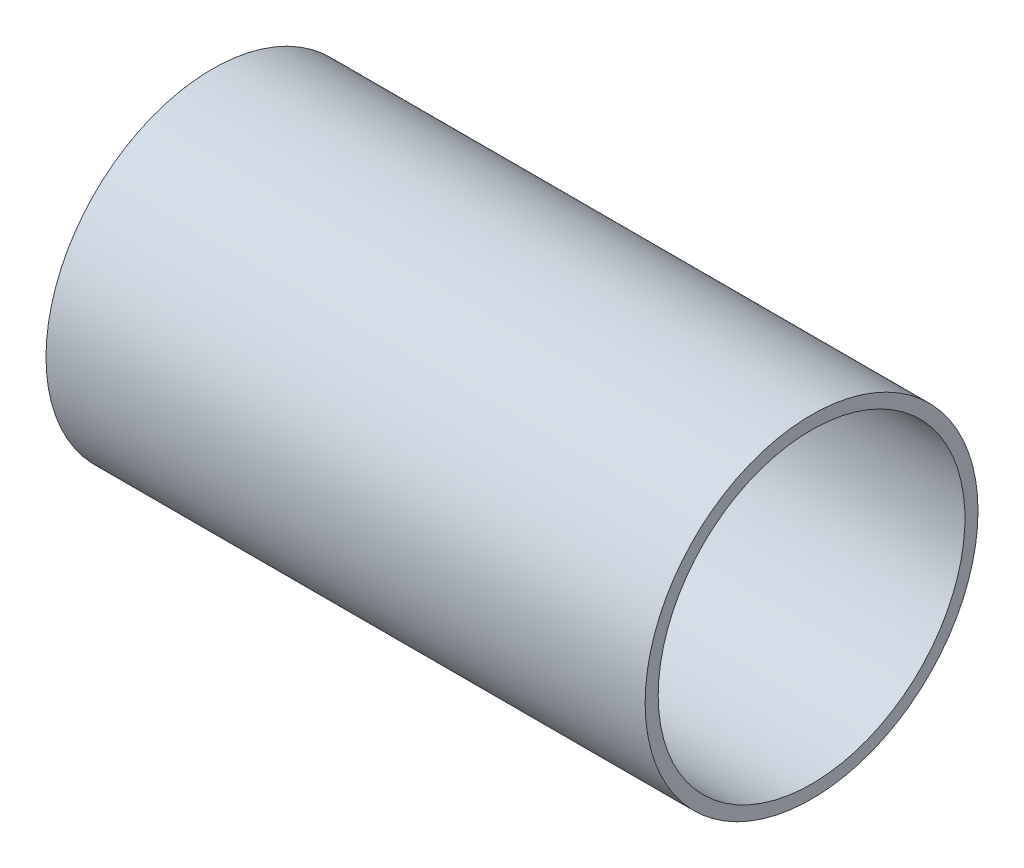
from build123d import *

# Parameters (mm, degrees)
SKETCH1_W = 57.15
SKETCH1_H = 1.2446


with BuildPart() as part:
    # Sketch1 → Revolve1 (revolve)
    with BuildSketch(Plane(origin=(0, 0, 0), x_dir=(1, 0, 0), z_dir=(0, 1, 0)), mode=Mode.PRIVATE) as revolve1_sk:
        with Locations((0, 15.2527)):
            Rectangle(SKETCH1_W, SKETCH1_H)
    revolve(revolve1_sk.sketch.rotate(Axis((-72.893991897, 0, 0), (1, 0, 0)), 180), axis=Axis((-72.893991897, 0, 0), (1, 0, 0)))


solid = part.part
